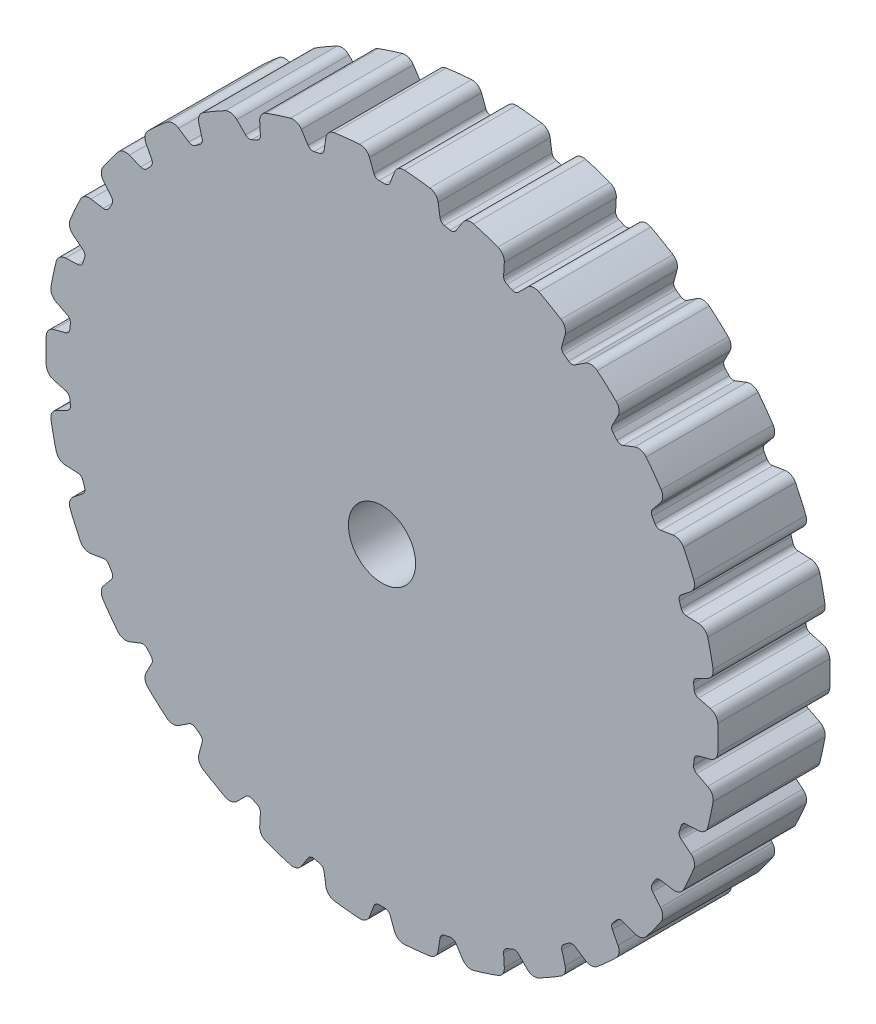
from build123d import *

# Parameters (mm, degrees)
SKETCH1_R           = 38.1
BOSS_EXTRUDE1_DEPTH = 12.7
SKETCH2_R           = 3.81
CUT_EXTRUDE1_DEPTH  = 56.358016583
CUT_EXTRUDE2_DEPTH  = 56.358016583


with BuildPart() as part:
    # Sketch1 → Boss-Extrude1 (new body)
    with BuildSketch(Plane.XY):
        Circle(SKETCH1_R)
    extrude(amount=BOSS_EXTRUDE1_DEPTH)

    # Sketch2 → Cut-Extrude1 (cut, through all)
    with BuildSketch(Plane.XY.offset(12.7)):
        Circle(SKETCH2_R)
    extrude(amount=-CUT_EXTRUDE1_DEPTH, mode=Mode.SUBTRACT)

    # Sketch3 → Cut-Extrude2 (cut, through all)
    with BuildSketch(Plane.XY.offset(12.7)):
        with BuildLine():
            Line((-1.416877441, 37.27949239), (-0.922266672, 35.970543408))
            ThreePointArc((-0.922266672, 35.970543408), (-0.689296484, 35.672623251), (-0.328259737, 35.56))
            Line((-0.328259737, 35.56), (0.328259737, 35.56))
            ThreePointArc((0.328259737, 35.56), (0.689296484, 35.672623251), (0.922266672, 35.970543408))
            Line((0.922266672, 35.970543408), (1.416877441, 37.27949239))
            ThreePointArc((1.416877441, 37.27949239), (1.858655341, 37.83021591), (2.54, 38.01523905))
            ThreePointArc((2.54, 38.01523905), (0, 38.1), (-2.54, 38.01523905))
            ThreePointArc((-2.54, 38.01523905), (-1.858655341, 37.83021591), (-1.416877441, 37.27949239))
        make_face()
        with BuildLine():
            Line((7.072253251, 34.851177719), (7.7144262, 34.714679645))
            ThreePointArc((7.7144262, 34.714679645), (8.090989118, 34.749778048), (8.380809432, 34.992750709))
            Line((8.380809432, 34.992750709), (9.136757565, 36.170260653))
            ThreePointArc((9.136757565, 36.170260653), (9.683383416, 36.617098753), (10.388307534, 36.656419173))
            ThreePointArc((10.388307534, 36.656419173), (7.92143542, 37.267423588), (5.419317722, 37.712610562))
            ThreePointArc((5.419317722, 37.712610562), (6.047304892, 37.389971102), (6.364927026, 36.759431422))
            Line((6.364927026, 36.759431422), (6.576583567, 35.376250755))
            ThreePointArc((6.576583567, 35.376250755), (6.742521714, 35.036403642), (7.072253251, 34.851177719))
        make_face()
        with BuildLine():
            Line((14.163674836, 32.619191737), (14.76343522, 32.35216121))
            ThreePointArc((14.76343522, 32.35216121), (15.139066702, 32.308200795), (15.473070605, 32.485606889))
            Line((15.473070605, 32.485606889), (16.457317541, 33.480214962))
            ThreePointArc((16.457317541, 33.480214962), (17.08490117, 33.803638672), (17.782596179, 33.695537882))
            ThreePointArc((17.782596179, 33.695537882), (15.496666101, 34.806081936), (13.141785254, 35.761760028))
            ThreePointArc((13.141785254, 35.761760028), (13.688968882, 35.31560514), (13.86855364, 34.63280691))
            Line((13.86855364, 34.63280691), (13.788005547, 33.23584619))
            ThreePointArc((13.788005547, 33.23584619), (13.879659359, 32.868925071), (14.163674836, 32.619191737))
        make_face()
        with BuildLine():
            Line((20.636075865, 28.961590553), (21.167211278, 28.575698087))
            ThreePointArc((21.167211278, 28.575698087), (21.525494427, 28.454600137), (21.889084343, 28.558686166))
            Line((21.889084343, 28.558686166), (23.058613769, 29.326923221))
            ThreePointArc((23.058613769, 29.326923221), (23.73972676, 29.512797373), (24.399700041, 29.261999896))
            ThreePointArc((24.399700041, 29.261999896), (22.394618112, 30.823547486), (20.28989371, 32.247948977))
            ThreePointArc((20.28989371, 32.247948977), (20.732359245, 31.69777777), (20.766057911, 30.992562549))
            Line((20.766057911, 30.992562549), (20.396825521, 29.642875663))
            ThreePointArc((20.396825521, 29.642875663), (20.410189288, 29.264916752), (20.636075865, 28.961590553))
        make_face()
        with BuildLine():
            Line((26.206581357, 24.038228887), (26.645878631, 23.550339837))
            ThreePointArc((26.645878631, 23.550339837), (26.971154754, 23.357396911), (27.348440061, 23.383613817))
            Line((27.348440061, 23.383613817), (28.652137927, 23.891904209))
            ThreePointArc((28.652137927, 23.891904209), (29.357012375, 23.932105212), (29.950419929, 23.549572099))
            ThreePointArc((29.950419929, 23.549572099), (28.313817851, 25.493876102), (26.551236449, 27.324747813))
            ThreePointArc((26.551236449, 27.324747813), (26.869646025, 26.694605409), (26.755985804, 25.997794487))
            Line((26.755985804, 25.997794487), (26.114206346, 24.754369227))
            ThreePointArc((26.114206346, 24.754369227), (26.048696006, 24.381891141), (26.206581357, 24.038228887))
        make_face()
        with BuildLine():
            Line((30.63173349, 18.064281272), (30.959993227, 17.495718728))
            ThreePointArc((30.959993227, 17.495718728), (31.238046197, 17.23936336), (31.612537716, 17.186565337))
            Line((31.612537716, 17.186565337), (32.993426171, 17.412694337))
            ThreePointArc((32.993426171, 17.412694337), (33.691255679, 17.305465213), (34.192162748, 16.807914999))
            ThreePointArc((34.192162748, 16.807914999), (32.995567884, 19.05), (31.652162748, 21.20732405))
            ThreePointArc((31.652162748, 21.20732405), (31.832600338, 20.524750697), (31.576548729, 19.866798053))
            Line((31.576548729, 19.866798053), (30.690271044, 18.783978071))
            ThreePointArc((30.690271044, 18.783978071), (30.548749713, 18.433259891), (30.63173349, 18.064281272))
        make_face()
        with BuildLine():
            Line((33.718131882, 11.300837882), (33.921007557, 10.676450758))
            ThreePointArc((33.921007557, 10.676450758), (34.139685124, 10.367886906), (34.495015778, 10.238381482))
            Line((34.495015778, 10.238381482), (35.89274337, 10.172466167))
            ThreePointArc((35.89274337, 10.172466167), (36.553029441, 9.922493344), (36.939543982, 9.33167136))
            ThreePointArc((36.939543982, 9.33167136), (36.235253271, 11.773547486), (35.369737651, 14.163038463))
            ThreePointArc((35.369737651, 14.163038463), (35.404317267, 13.45786589), (35.017064953, 12.867527214))
            Line((35.017064953, 12.867527214), (33.925023628, 11.992636938))
            ThreePointArc((33.925023628, 11.992636938), (33.713676469, 11.679006731), (33.718131882, 11.300837882))
        make_face()
        with BuildLine():
            Line((35.330886113, 4.04349365), (35.399511085, 3.390570658))
            ThreePointArc((35.399511085, 3.390570658), (35.549255991, 3.043284044), (35.869896126, 2.842731227))
            Line((35.869896126, 2.842731227), (37.223375452, 2.487652412))
            ThreePointArc((37.223375452, 2.487652412), (37.817260415, 2.105860902), (38.072489889, 1.447588904))
            ThreePointArc((38.072489889, 1.447588904), (37.891284214, 3.98253445), (37.541485296, 6.499760133))
            ThreePointArc((37.541485296, 6.499760133), (37.428695642, 5.802807766), (36.927167408, 5.305883689))
            Line((36.927167408, 5.305883689), (35.67708989, 4.677160024))
            ThreePointArc((35.67708989, 4.677160024), (35.405153786, 4.414324935), (35.330886113, 4.04349365))
        make_face()
        with BuildLine():
            Line((35.399511085, -3.390570658), (35.330886113, -4.04349365))
            ThreePointArc((35.330886113, -4.04349365), (35.405153786, -4.414324935), (35.67708989, -4.677160024))
            Line((35.67708989, -4.677160024), (36.927167408, -5.305883689))
            ThreePointArc((36.927167408, -5.305883689), (37.428695642, -5.802807766), (37.541485296, -6.499760133))
            ThreePointArc((37.541485296, -6.499760133), (37.891284214, -3.98253445), (38.072489889, -1.447588904))
            ThreePointArc((38.072489889, -1.447588904), (37.817260415, -2.105860902), (37.223375452, -2.487652412))
            Line((37.223375452, -2.487652412), (35.869896126, -2.842731227))
            ThreePointArc((35.869896126, -2.842731227), (35.549255991, -3.043284044), (35.399511085, -3.390570658))
        make_face()
        with BuildLine():
            Line((33.921007557, -10.676450758), (33.718131882, -11.300837882))
            ThreePointArc((33.718131882, -11.300837882), (33.713676469, -11.679006731), (33.925023628, -11.992636938))
            Line((33.925023628, -11.992636938), (35.017064953, -12.867527214))
            ThreePointArc((35.017064953, -12.867527214), (35.404317267, -13.45786589), (35.369737651, -14.163038463))
            ThreePointArc((35.369737651, -14.163038463), (36.235253271, -11.773547486), (36.939543982, -9.33167136))
            ThreePointArc((36.939543982, -9.33167136), (36.553029441, -9.922493344), (35.89274337, -10.172466167))
            Line((35.89274337, -10.172466167), (34.495015778, -10.238381482))
            ThreePointArc((34.495015778, -10.238381482), (34.139685124, -10.367886906), (33.921007557, -10.676450758))
        make_face()
        with BuildLine():
            Line((30.959993227, -17.495718728), (30.63173349, -18.064281272))
            ThreePointArc((30.63173349, -18.064281272), (30.548749713, -18.433259891), (30.690271044, -18.783978071))
            Line((30.690271044, -18.783978071), (31.576548729, -19.866798053))
            ThreePointArc((31.576548729, -19.866798053), (31.832600338, -20.524750697), (31.652162748, -21.20732405))
            ThreePointArc((31.652162748, -21.20732405), (32.995567884, -19.05), (34.192162748, -16.807914999))
            ThreePointArc((34.192162748, -16.807914999), (33.691255679, -17.305465213), (32.993426171, -17.412694337))
            Line((32.993426171, -17.412694337), (31.612537716, -17.186565337))
            ThreePointArc((31.612537716, -17.186565337), (31.238046197, -17.23936336), (30.959993227, -17.495718728))
        make_face()
        with BuildLine():
            Line((26.645878631, -23.550339837), (26.206581357, -24.038228887))
            ThreePointArc((26.206581357, -24.038228887), (26.048696006, -24.381891141), (26.114206346, -24.754369227))
            Line((26.114206346, -24.754369227), (26.755985804, -25.997794487))
            ThreePointArc((26.755985804, -25.997794487), (26.869646025, -26.694605409), (26.551236449, -27.324747813))
            ThreePointArc((26.551236449, -27.324747813), (28.313817851, -25.493876102), (29.950419929, -23.549572099))
            ThreePointArc((29.950419929, -23.549572099), (29.357012375, -23.932105212), (28.652137927, -23.891904209))
            Line((28.652137927, -23.891904209), (27.348440061, -23.383613817))
            ThreePointArc((27.348440061, -23.383613817), (26.971154754, -23.357396911), (26.645878631, -23.550339837))
        make_face()
        with BuildLine():
            Line((21.167211278, -28.575698087), (20.636075865, -28.961590553))
            ThreePointArc((20.636075865, -28.961590553), (20.410189288, -29.264916752), (20.396825521, -29.642875663))
            Line((20.396825521, -29.642875663), (20.766057911, -30.992562549))
            ThreePointArc((20.766057911, -30.992562549), (20.732359245, -31.69777777), (20.28989371, -32.247948977))
            ThreePointArc((20.28989371, -32.247948977), (22.394618112, -30.823547486), (24.399700041, -29.261999896))
            ThreePointArc((24.399700041, -29.261999896), (23.73972676, -29.512797373), (23.058613769, -29.326923221))
            Line((23.058613769, -29.326923221), (21.889084343, -28.558686166))
            ThreePointArc((21.889084343, -28.558686166), (21.525494427, -28.454600137), (21.167211278, -28.575698087))
        make_face()
        with BuildLine():
            Line((14.76343522, -32.35216121), (14.163674836, -32.619191737))
            ThreePointArc((14.163674836, -32.619191737), (13.879659359, -32.868925071), (13.788005547, -33.23584619))
            Line((13.788005547, -33.23584619), (13.86855364, -34.63280691))
            ThreePointArc((13.86855364, -34.63280691), (13.688968882, -35.31560514), (13.141785254, -35.761760028))
            ThreePointArc((13.141785254, -35.761760028), (15.496666101, -34.806081936), (17.782596179, -33.695537882))
            ThreePointArc((17.782596179, -33.695537882), (17.08490117, -33.803638672), (16.457317541, -33.480214962))
            Line((16.457317541, -33.480214962), (15.473070605, -32.485606889))
            ThreePointArc((15.473070605, -32.485606889), (15.139066702, -32.308200795), (14.76343522, -32.35216121))
        make_face()
        with BuildLine():
            Line((7.7144262, -34.714679645), (7.072253251, -34.851177719))
            ThreePointArc((7.072253251, -34.851177719), (6.742521714, -35.036403642), (6.576583567, -35.376250755))
            Line((6.576583567, -35.376250755), (6.364927026, -36.759431422))
            ThreePointArc((6.364927026, -36.759431422), (6.047304892, -37.389971102), (5.419317722, -37.712610562))
            ThreePointArc((5.419317722, -37.712610562), (7.92143542, -37.267423588), (10.388307534, -36.656419173))
            ThreePointArc((10.388307534, -36.656419173), (9.683383416, -36.617098753), (9.136757565, -36.170260653))
            Line((9.136757565, -36.170260653), (8.380809432, -34.992750709))
            ThreePointArc((8.380809432, -34.992750709), (8.090989118, -34.749778048), (7.7144262, -34.714679645))
        make_face()
        with BuildLine():
            Line((0.328259737, -35.56), (-0.328259737, -35.56))
            ThreePointArc((-0.328259737, -35.56), (-0.689296484, -35.672623251), (-0.922266672, -35.970543408))
            Line((-0.922266672, -35.970543408), (-1.416877441, -37.27949239))
            ThreePointArc((-1.416877441, -37.27949239), (-1.858655341, -37.83021591), (-2.54, -38.01523905))
            ThreePointArc((-2.54, -38.01523905), (0, -38.1), (2.54, -38.01523905))
            ThreePointArc((2.54, -38.01523905), (1.858655341, -37.83021591), (1.416877441, -37.27949239))
            Line((1.416877441, -37.27949239), (0.922266672, -35.970543408))
            ThreePointArc((0.922266672, -35.970543408), (0.689296484, -35.672623251), (0.328259737, -35.56))
        make_face()
        with BuildLine():
            Line((-7.072253251, -34.851177719), (-7.7144262, -34.714679645))
            ThreePointArc((-7.7144262, -34.714679645), (-8.090989118, -34.749778048), (-8.380809432, -34.992750709))
            Line((-8.380809432, -34.992750709), (-9.136757565, -36.170260653))
            ThreePointArc((-9.136757565, -36.170260653), (-9.683383416, -36.617098753), (-10.388307534, -36.656419173))
            ThreePointArc((-10.388307534, -36.656419173), (-7.92143542, -37.267423588), (-5.419317722, -37.712610562))
            ThreePointArc((-5.419317722, -37.712610562), (-6.047304892, -37.389971102), (-6.364927026, -36.759431422))
            Line((-6.364927026, -36.759431422), (-6.576583567, -35.376250755))
            ThreePointArc((-6.576583567, -35.376250755), (-6.742521714, -35.036403642), (-7.072253251, -34.851177719))
        make_face()
        with BuildLine():
            Line((-14.163674836, -32.619191737), (-14.76343522, -32.35216121))
            ThreePointArc((-14.76343522, -32.35216121), (-15.139066702, -32.308200795), (-15.473070605, -32.485606889))
            Line((-15.473070605, -32.485606889), (-16.457317541, -33.480214962))
            ThreePointArc((-16.457317541, -33.480214962), (-17.08490117, -33.803638672), (-17.782596179, -33.695537882))
            ThreePointArc((-17.782596179, -33.695537882), (-15.496666101, -34.806081936), (-13.141785254, -35.761760028))
            ThreePointArc((-13.141785254, -35.761760028), (-13.688968882, -35.31560514), (-13.86855364, -34.63280691))
            Line((-13.86855364, -34.63280691), (-13.788005547, -33.23584619))
            ThreePointArc((-13.788005547, -33.23584619), (-13.879659359, -32.868925071), (-14.163674836, -32.619191737))
        make_face()
        with BuildLine():
            Line((-20.636075865, -28.961590553), (-21.167211278, -28.575698087))
            ThreePointArc((-21.167211278, -28.575698087), (-21.525494427, -28.454600137), (-21.889084343, -28.558686166))
            Line((-21.889084343, -28.558686166), (-23.058613769, -29.326923221))
            ThreePointArc((-23.058613769, -29.326923221), (-23.73972676, -29.512797373), (-24.399700041, -29.261999896))
            ThreePointArc((-24.399700041, -29.261999896), (-22.394618112, -30.823547486), (-20.28989371, -32.247948977))
            ThreePointArc((-20.28989371, -32.247948977), (-20.732359245, -31.69777777), (-20.766057911, -30.992562549))
            Line((-20.766057911, -30.992562549), (-20.396825521, -29.642875663))
            ThreePointArc((-20.396825521, -29.642875663), (-20.410189288, -29.264916752), (-20.636075865, -28.961590553))
        make_face()
        with BuildLine():
            Line((-26.206581357, -24.038228887), (-26.645878631, -23.550339837))
            ThreePointArc((-26.645878631, -23.550339837), (-26.971154754, -23.357396911), (-27.348440061, -23.383613817))
            Line((-27.348440061, -23.383613817), (-28.652137927, -23.891904209))
            ThreePointArc((-28.652137927, -23.891904209), (-29.357012375, -23.932105212), (-29.950419929, -23.549572099))
            ThreePointArc((-29.950419929, -23.549572099), (-28.313817851, -25.493876102), (-26.551236449, -27.324747813))
            ThreePointArc((-26.551236449, -27.324747813), (-26.869646025, -26.694605409), (-26.755985804, -25.997794487))
            Line((-26.755985804, -25.997794487), (-26.114206346, -24.754369227))
            ThreePointArc((-26.114206346, -24.754369227), (-26.048696006, -24.381891141), (-26.206581357, -24.038228887))
        make_face()
        with BuildLine():
            Line((-30.63173349, -18.064281272), (-30.959993227, -17.495718728))
            ThreePointArc((-30.959993227, -17.495718728), (-31.238046197, -17.23936336), (-31.612537716, -17.186565337))
            Line((-31.612537716, -17.186565337), (-32.993426171, -17.412694337))
            ThreePointArc((-32.993426171, -17.412694337), (-33.691255679, -17.305465213), (-34.192162748, -16.807914999))
            ThreePointArc((-34.192162748, -16.807914999), (-32.995567884, -19.05), (-31.652162748, -21.20732405))
            ThreePointArc((-31.652162748, -21.20732405), (-31.832600338, -20.524750697), (-31.576548729, -19.866798053))
            Line((-31.576548729, -19.866798053), (-30.690271044, -18.783978071))
            ThreePointArc((-30.690271044, -18.783978071), (-30.548749713, -18.433259891), (-30.63173349, -18.064281272))
        make_face()
        with BuildLine():
            Line((-33.718131882, -11.300837882), (-33.921007557, -10.676450758))
            ThreePointArc((-33.921007557, -10.676450758), (-34.139685124, -10.367886906), (-34.495015778, -10.238381482))
            Line((-34.495015778, -10.238381482), (-35.89274337, -10.172466167))
            ThreePointArc((-35.89274337, -10.172466167), (-36.553029441, -9.922493344), (-36.939543982, -9.33167136))
            ThreePointArc((-36.939543982, -9.33167136), (-36.235253271, -11.773547486), (-35.369737651, -14.163038463))
            ThreePointArc((-35.369737651, -14.163038463), (-35.404317267, -13.45786589), (-35.017064953, -12.867527214))
            Line((-35.017064953, -12.867527214), (-33.925023628, -11.992636938))
            ThreePointArc((-33.925023628, -11.992636938), (-33.713676469, -11.679006731), (-33.718131882, -11.300837882))
        make_face()
        with BuildLine():
            Line((-35.330886113, -4.04349365), (-35.399511085, -3.390570658))
            ThreePointArc((-35.399511085, -3.390570658), (-35.549255991, -3.043284044), (-35.869896126, -2.842731227))
            Line((-35.869896126, -2.842731227), (-37.223375452, -2.487652412))
            ThreePointArc((-37.223375452, -2.487652412), (-37.817260415, -2.105860902), (-38.072489889, -1.447588904))
            ThreePointArc((-38.072489889, -1.447588904), (-37.891284214, -3.98253445), (-37.541485296, -6.499760133))
            ThreePointArc((-37.541485296, -6.499760133), (-37.428695642, -5.802807766), (-36.927167408, -5.305883689))
            Line((-36.927167408, -5.305883689), (-35.67708989, -4.677160024))
            ThreePointArc((-35.67708989, -4.677160024), (-35.405153786, -4.414324935), (-35.330886113, -4.04349365))
        make_face()
        with BuildLine():
            Line((-35.399511085, 3.390570658), (-35.330886113, 4.04349365))
            ThreePointArc((-35.330886113, 4.04349365), (-35.405153786, 4.414324935), (-35.67708989, 4.677160024))
            Line((-35.67708989, 4.677160024), (-36.927167408, 5.305883689))
            ThreePointArc((-36.927167408, 5.305883689), (-37.428695642, 5.802807766), (-37.541485296, 6.499760133))
            ThreePointArc((-37.541485296, 6.499760133), (-37.891284214, 3.98253445), (-38.072489889, 1.447588904))
            ThreePointArc((-38.072489889, 1.447588904), (-37.817260415, 2.105860902), (-37.223375452, 2.487652412))
            Line((-37.223375452, 2.487652412), (-35.869896126, 2.842731227))
            ThreePointArc((-35.869896126, 2.842731227), (-35.549255991, 3.043284044), (-35.399511085, 3.390570658))
        make_face()
        with BuildLine():
            Line((-33.921007557, 10.676450758), (-33.718131882, 11.300837882))
            ThreePointArc((-33.718131882, 11.300837882), (-33.713676469, 11.679006731), (-33.925023628, 11.992636938))
            Line((-33.925023628, 11.992636938), (-35.017064953, 12.867527214))
            ThreePointArc((-35.017064953, 12.867527214), (-35.404317267, 13.45786589), (-35.369737651, 14.163038463))
            ThreePointArc((-35.369737651, 14.163038463), (-36.235253271, 11.773547486), (-36.939543982, 9.33167136))
            ThreePointArc((-36.939543982, 9.33167136), (-36.553029441, 9.922493344), (-35.89274337, 10.172466167))
            Line((-35.89274337, 10.172466167), (-34.495015778, 10.238381482))
            ThreePointArc((-34.495015778, 10.238381482), (-34.139685124, 10.367886906), (-33.921007557, 10.676450758))
        make_face()
        with BuildLine():
            Line((-30.959993227, 17.495718728), (-30.63173349, 18.064281272))
            ThreePointArc((-30.63173349, 18.064281272), (-30.548749713, 18.433259891), (-30.690271044, 18.783978071))
            Line((-30.690271044, 18.783978071), (-31.576548729, 19.866798053))
            ThreePointArc((-31.576548729, 19.866798053), (-31.832600338, 20.524750697), (-31.652162748, 21.20732405))
            ThreePointArc((-31.652162748, 21.20732405), (-32.995567884, 19.05), (-34.192162748, 16.807914999))
            ThreePointArc((-34.192162748, 16.807914999), (-33.691255679, 17.305465213), (-32.993426171, 17.412694337))
            Line((-32.993426171, 17.412694337), (-31.612537716, 17.186565337))
            ThreePointArc((-31.612537716, 17.186565337), (-31.238046197, 17.23936336), (-30.959993227, 17.495718728))
        make_face()
        with BuildLine():
            Line((-26.645878631, 23.550339837), (-26.206581357, 24.038228887))
            ThreePointArc((-26.206581357, 24.038228887), (-26.048696006, 24.381891141), (-26.114206346, 24.754369227))
            Line((-26.114206346, 24.754369227), (-26.755985804, 25.997794487))
            ThreePointArc((-26.755985804, 25.997794487), (-26.869646025, 26.694605409), (-26.551236449, 27.324747813))
            ThreePointArc((-26.551236449, 27.324747813), (-28.313817851, 25.493876102), (-29.950419929, 23.549572099))
            ThreePointArc((-29.950419929, 23.549572099), (-29.357012375, 23.932105212), (-28.652137927, 23.891904209))
            Line((-28.652137927, 23.891904209), (-27.348440061, 23.383613817))
            ThreePointArc((-27.348440061, 23.383613817), (-26.971154754, 23.357396911), (-26.645878631, 23.550339837))
        make_face()
        with BuildLine():
            Line((-21.167211278, 28.575698087), (-20.636075865, 28.961590553))
            ThreePointArc((-20.636075865, 28.961590553), (-20.410189288, 29.264916752), (-20.396825521, 29.642875663))
            Line((-20.396825521, 29.642875663), (-20.766057911, 30.992562549))
            ThreePointArc((-20.766057911, 30.992562549), (-20.732359245, 31.69777777), (-20.28989371, 32.247948977))
            ThreePointArc((-20.28989371, 32.247948977), (-22.394618112, 30.823547486), (-24.399700041, 29.261999896))
            ThreePointArc((-24.399700041, 29.261999896), (-23.73972676, 29.512797373), (-23.058613769, 29.326923221))
            Line((-23.058613769, 29.326923221), (-21.889084343, 28.558686166))
            ThreePointArc((-21.889084343, 28.558686166), (-21.525494427, 28.454600137), (-21.167211278, 28.575698087))
        make_face()
        with BuildLine():
            Line((-14.76343522, 32.35216121), (-14.163674836, 32.619191737))
            ThreePointArc((-14.163674836, 32.619191737), (-13.879659359, 32.868925071), (-13.788005547, 33.23584619))
            Line((-13.788005547, 33.23584619), (-13.86855364, 34.63280691))
            ThreePointArc((-13.86855364, 34.63280691), (-13.688968882, 35.31560514), (-13.141785254, 35.761760028))
            ThreePointArc((-13.141785254, 35.761760028), (-15.496666101, 34.806081936), (-17.782596179, 33.695537882))
            ThreePointArc((-17.782596179, 33.695537882), (-17.08490117, 33.803638672), (-16.457317541, 33.480214962))
            Line((-16.457317541, 33.480214962), (-15.473070605, 32.485606889))
            ThreePointArc((-15.473070605, 32.485606889), (-15.139066702, 32.308200795), (-14.76343522, 32.35216121))
        make_face()
        with BuildLine():
            Line((-7.7144262, 34.714679645), (-7.072253251, 34.851177719))
            ThreePointArc((-7.072253251, 34.851177719), (-6.742521714, 35.036403642), (-6.576583567, 35.376250755))
            Line((-6.576583567, 35.376250755), (-6.364927026, 36.759431422))
            ThreePointArc((-6.364927026, 36.759431422), (-6.047304892, 37.389971102), (-5.419317722, 37.712610562))
            ThreePointArc((-5.419317722, 37.712610562), (-7.92143542, 37.267423588), (-10.388307534, 36.656419173))
            ThreePointArc((-10.388307534, 36.656419173), (-9.683383416, 36.617098753), (-9.136757565, 36.170260653))
            Line((-9.136757565, 36.170260653), (-8.380809432, 34.992750709))
            ThreePointArc((-8.380809432, 34.992750709), (-8.090989118, 34.749778048), (-7.7144262, 34.714679645))
        make_face()
    extrude(amount=-CUT_EXTRUDE2_DEPTH, mode=Mode.SUBTRACT)


solid = part.part
